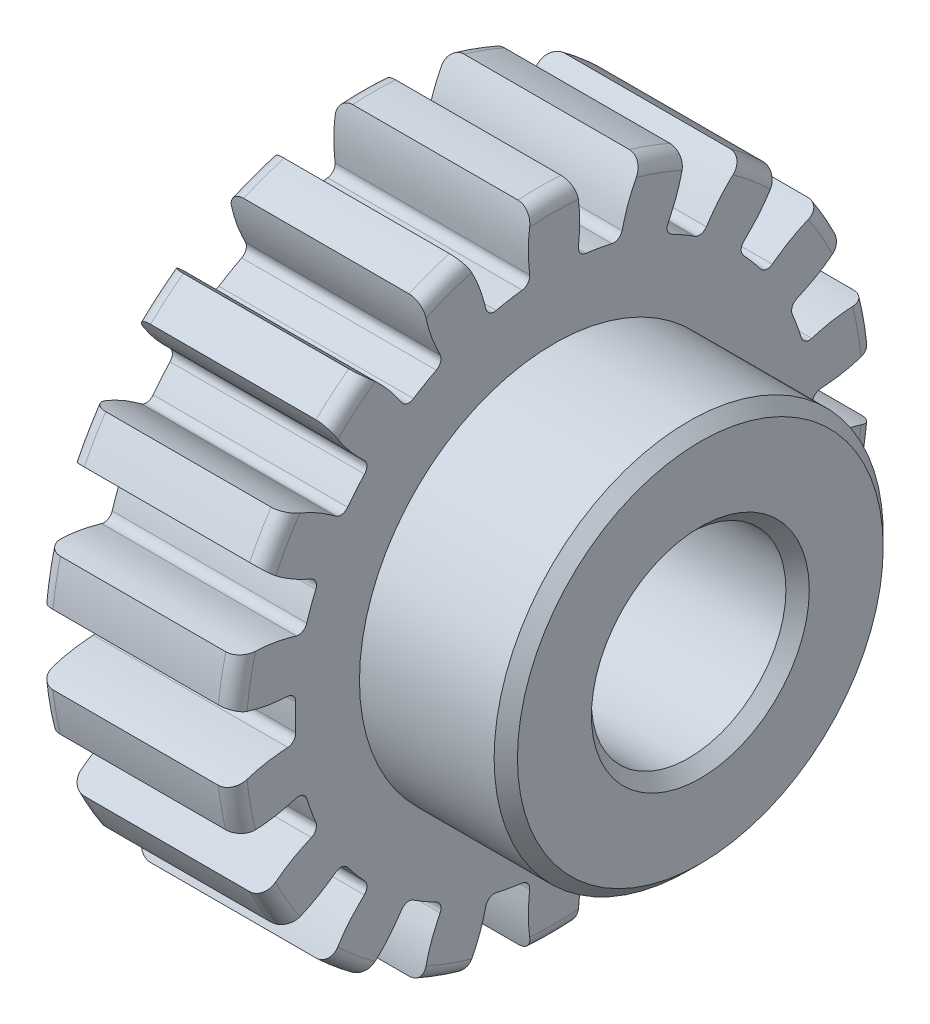
from build123d import *

# Parameters (mm, degrees)
FILLET1_R                = 0.47625
FILLET2_R                = 0.280511684
CIRPATTERN4_COUNT        = 18
FILLET2_OF_CIRPATTERN4_R = 0.280511684
CHAMFER1_SIZE            = 0.381


with BuildPart() as part:
    # Sketch12 → Revolve3 (revolve)
    with BuildSketch(Plane.XY, mode=Mode.PRIVATE) as revolve3_sk:
        Polygon((-5.5626, 10.541), (-5.5626, 3.175), (5.5626, 3.175), (5.5626, 6.35), (0.7874, 6.35), (0.7874, 10.541), align=None)
    revolve(revolve3_sk.sketch.rotate(Axis((0, 0, 0), (1, 0, 0)), 90), axis=Axis((0, 0, 0), (1, 0, 0)))

    # Fillet1
    fillet1_edges = [part.edges().sort_by_distance(p)[0] for p in [
        (-5.5626, 0, -10.541),
        (0.7874, 0, -10.541),
    ]]
    fillet(fillet1_edges, radius=FILLET1_R)

    # Cut-Sweep1: sweep along a path in Sketch7
    with BuildLine(Plane.XY) as cut_sweep1_path:
        Line((-5.5626, 0), (0.7874, 0))
    # Sketch6 → Cut-Sweep1 (sweep, cut)
    with BuildSketch(Plane(origin=(-5.5626, 0, 0), x_dir=(0, 0, -1), z_dir=(-1, 0, 0))):
        with BuildLine():
            Line((-8.41400163, -0.701279211), (-8.953044741, -0.746206671))
            ThreePointArc((-8.953044741, -0.746206671), (-9.732635824, -0.8773488), (-10.479579838, -1.136260282))
            ThreePointArc((-10.479579838, -1.136260282), (-10.541, 0), (-10.479579838, 1.136260282))
            ThreePointArc((-10.479579838, 1.136260282), (-9.732635824, 0.8773488), (-8.953044741, 0.746206671))
            Line((-8.953044741, 0.746206671), (-8.41400163, 0.701279211))
            ThreePointArc((-8.41400163, 0.701279211), (-8.443175704, 0), (-8.41400163, -0.701279211))
        make_face()
    cut_sweep1 = sweep(path=cut_sweep1_path.line, mode=Mode.SUBTRACT)

    # Fillet2
    fillet2_edges = [part.edges().sort_by_distance(p)[0] for p in [
        (-2.3876, -0.701279211, 8.41400163),
        (-2.3876, 0.701279211, 8.41400163),
    ]]
    fillet(fillet2_edges, radius=FILLET2_R)

    # CirPattern4: Cut-Sweep1 ×18 about axis
    cirpattern4_axis = Axis((-5.5626, 0, 0), (1, 0, 0))
    for i in range(1, CIRPATTERN4_COUNT):
        add(cut_sweep1.rotate(cirpattern4_axis, i * 360 / CIRPATTERN4_COUNT), mode=Mode.SUBTRACT)

    # Fillet2 of CirPattern4
    fillet2_of_cirpattern4_edges = [part.edges().sort_by_distance(p)[0] for p in [
        (-2.3876, -3.536744943, 7.666723627),
        (-2.3876, -2.218771144, 8.146426859),
        (-2.3876, -5.945627038, 5.994725606),
        (-2.3876, -4.871204953, 6.89627278),
        (-2.3876, -7.637378764, 3.599675204),
        (-2.3876, -6.936099554, 4.814326426),
        (-2.3876, -8.407949896, 0.770450846),
        (-2.3876, -8.164398182, 2.151701253),
        (-2.3876, -8.164398182, -2.151701253),
        (-2.3876, -8.407949896, -0.770450846),
        (-2.3876, -6.936099554, -4.814326426),
        (-2.3876, -7.637378764, -3.599675204),
        (-2.3876, -4.871204953, -6.89627278),
        (-2.3876, -5.945627038, -5.994725606),
        (-2.3876, -2.218771144, -8.146426859),
        (-2.3876, -3.536744943, -7.666723627),
        (-2.3876, 0.701279211, -8.41400163),
        (-2.3876, -0.701279211, -8.41400163),
        (-2.3876, 3.536744943, -7.666723627),
        (-2.3876, 2.218771144, -8.146426859),
        (-2.3876, 5.945627038, -5.994725606),
        (-2.3876, 4.871204953, -6.89627278),
        (-2.3876, 7.637378764, -3.599675204),
        (-2.3876, 6.936099554, -4.814326426),
        (-2.3876, 8.407949896, -0.770450846),
        (-2.3876, 8.164398182, -2.151701253),
        (-2.3876, 8.164398182, 2.151701253),
        (-2.3876, 8.407949896, 0.770450846),
        (-2.3876, 6.936099554, 4.814326426),
        (-2.3876, 7.637378764, 3.599675204),
        (-2.3876, 4.871204953, 6.89627278),
        (-2.3876, 5.945627038, 5.994725606),
        (-2.3876, 2.218771144, 8.146426859),
        (-2.3876, 3.536744943, 7.666723627),
    ]]
    fillet(fillet2_of_cirpattern4_edges, radius=FILLET2_OF_CIRPATTERN4_R)

    # Chamfer1
    chamfer1_edges = [part.edges().sort_by_distance(p)[0] for p in [
        (-5.5626, 0, -3.175),
        (5.5626, 0, -3.175),
        (5.5626, 0, -6.35),
    ]]
    chamfer(chamfer1_edges, length=CHAMFER1_SIZE)


solid = part.part
